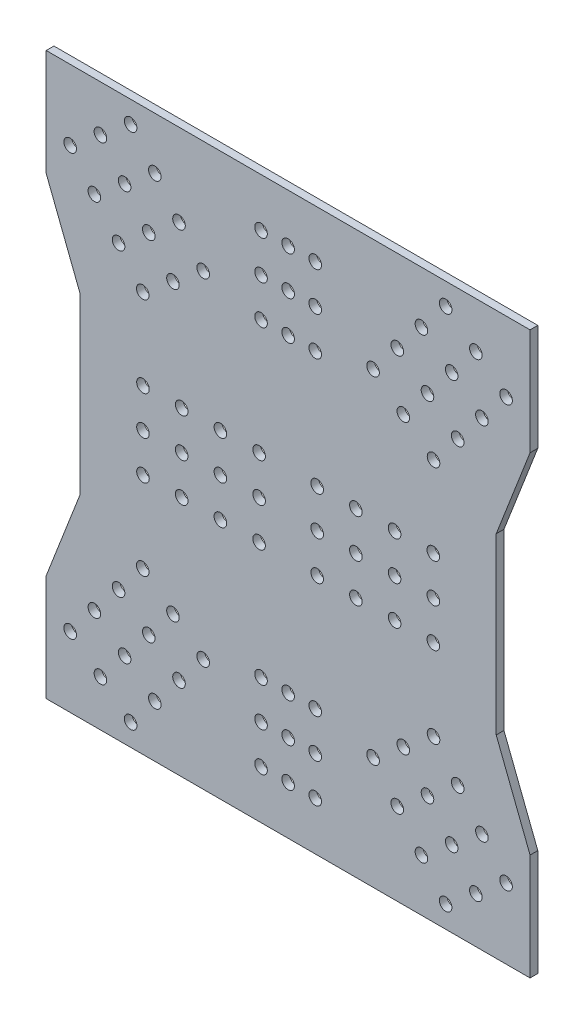
from build123d import *

# Parameters (mm, degrees)
SKETCH_2_W                        = 1000
SKETCH_2_H                        = 1160
EXTRUDE_1_DEPTH                   = 16
CUT_EXTRUDE_1_DEPTH               = 766.934723067
SKETCH_6_R                        = 13
CUT_EXTRUDE_2_DEPTH               = 766.934723067
PATTERN_LINEAR_1_COUNT            = 4
PATTERN_LINEAR_1_PITCH            = 80
PATTERN_LINEAR_1_COUNT_DIR2       = 3
PATTERN_LINEAR_1_PITCH_DIR2       = 80
PATTERN_LINEAR_2_COUNT            = 2
PATTERN_LINEAR_2_PITCH            = 360
PATTERN_LINEAR_2_COPY_1_SKETCH_R  = 13
PATTERN_LINEAR_2_COPY_1_DEPTH     = 766.934723067
PATTERN_LINEAR_2_COPY_2_SKETCH_R  = 13
PATTERN_LINEAR_2_COPY_2_DEPTH     = 766.934723067
PATTERN_LINEAR_2_COPY_3_SKETCH_R  = 13
PATTERN_LINEAR_2_COPY_3_DEPTH     = 766.934723067
PATTERN_LINEAR_2_COPY_4_SKETCH_R  = 13
PATTERN_LINEAR_2_COPY_4_DEPTH     = 766.934723067
PATTERN_LINEAR_2_COPY_5_SKETCH_R  = 13
PATTERN_LINEAR_2_COPY_5_DEPTH     = 766.934723067
PATTERN_LINEAR_2_COPY_6_SKETCH_R  = 13
PATTERN_LINEAR_2_COPY_6_DEPTH     = 766.934723067
PATTERN_LINEAR_2_COPY_7_SKETCH_R  = 13
PATTERN_LINEAR_2_COPY_7_DEPTH     = 766.934723067
PATTERN_LINEAR_2_COPY_8_SKETCH_R  = 13
PATTERN_LINEAR_2_COPY_8_DEPTH     = 766.934723067
PATTERN_LINEAR_2_COPY_9_SKETCH_R  = 13
PATTERN_LINEAR_2_COPY_9_DEPTH     = 766.934723067
PATTERN_LINEAR_2_COPY_10_SKETCH_R = 13
PATTERN_LINEAR_2_COPY_10_DEPTH    = 766.934723067
PATTERN_LINEAR_2_COPY_11_SKETCH_R = 13
PATTERN_LINEAR_2_COPY_11_DEPTH    = 766.934723067
SKETCH_7_R                        = 13
CUT_EXTRUDE_3_DEPTH               = 766.934723067
PATTERN_LINEAR_3_COUNT            = 3
PATTERN_LINEAR_3_PITCH            = 56
PATTERN_LINEAR_3_COUNT_DIR2       = 3
PATTERN_LINEAR_3_PITCH_DIR2       = 80
PATTERN_LINEAR_4_COUNT            = 2
PATTERN_LINEAR_4_PITCH            = 800
PATTERN_LINEAR_4_COPY_1_SKETCH_R  = 13
PATTERN_LINEAR_4_COPY_1_DEPTH     = 766.934723067
PATTERN_LINEAR_4_COPY_2_SKETCH_R  = 13
PATTERN_LINEAR_4_COPY_2_DEPTH     = 766.934723067
PATTERN_LINEAR_4_COPY_3_SKETCH_R  = 13
PATTERN_LINEAR_4_COPY_3_DEPTH     = 766.934723067
PATTERN_LINEAR_4_COPY_4_SKETCH_R  = 13
PATTERN_LINEAR_4_COPY_4_DEPTH     = 766.934723067
PATTERN_LINEAR_4_COPY_5_SKETCH_R  = 13
PATTERN_LINEAR_4_COPY_5_DEPTH     = 766.934723067
PATTERN_LINEAR_4_COPY_6_SKETCH_R  = 13
PATTERN_LINEAR_4_COPY_6_DEPTH     = 766.934723067
PATTERN_LINEAR_4_COPY_7_SKETCH_R  = 13
PATTERN_LINEAR_4_COPY_7_DEPTH     = 766.934723067
PATTERN_LINEAR_4_COPY_8_SKETCH_R  = 13
PATTERN_LINEAR_4_COPY_8_DEPTH     = 766.934723067
SKETCH_8_R                        = 13
CUT_EXTRUDE_4_DEPTH               = 766.934723067
MIRROR_2_COPY_1_SKETCH_R          = 13
MIRROR_2_COPY_1_DEPTH             = 766.934723067


with BuildPart() as part:
    # 草图2 → 凸台-拉伸1 (new body)
    with BuildSketch(Plane.XY):
        Rectangle(SKETCH_2_W, SKETCH_2_H)
    extrude(amount=EXTRUDE_1_DEPTH)

    # 草图4 → 切除-拉伸1 (cut, through all)
    with BuildSketch(Plane(origin=(0, 0, 0), x_dir=(-1, 0, 0), z_dir=(0, 0, -1))):
        Polygon((-500, 360), (-430, 180), (-430, -180), (-500, -360), align=None)
        Polygon((430, 180), (430, -180), (500, -360), (500, 360), align=None)
    extrude(amount=-CUT_EXTRUDE_1_DEPTH, mode=Mode.SUBTRACT)

    # 草图6 → 切除-拉伸2 (cut, through all)
    with BuildSketch(Plane.XY.offset(16)):
        with Locations((-60, 80)):
            Circle(SKETCH_6_R)
    cut_extrude_2 = extrude(amount=-CUT_EXTRUDE_2_DEPTH, mode=Mode.SUBTRACT)

    # 阵列(线性)1: Cut-Extrude 2 4 × 3
    with Locations(*[(-i * PATTERN_LINEAR_1_PITCH, -j * PATTERN_LINEAR_1_PITCH_DIR2, 0) for i in range(PATTERN_LINEAR_1_COUNT) for j in range(PATTERN_LINEAR_1_COUNT_DIR2) if (i, j) != (0, 0)]):
        add(cut_extrude_2, mode=Mode.SUBTRACT)

    # 阵列(线性)2: 切除-拉伸2 ×2
    with Locations(*[(i * PATTERN_LINEAR_2_PITCH, 0, 0) for i in range(1, PATTERN_LINEAR_2_COUNT)]):
        add(cut_extrude_2, mode=Mode.SUBTRACT)

    # 阵列(线性)2 copy 1 sketch → 阵列(线性)2 copy 1 (cut, through all)
    with BuildSketch(Plane(origin=(360, -80, 16), x_dir=(1, 0, 0), z_dir=(0, 0, 1))):
        with Locations((-60, 80)):
            Circle(PATTERN_LINEAR_2_COPY_1_SKETCH_R)
    extrude(amount=-PATTERN_LINEAR_2_COPY_1_DEPTH, mode=Mode.SUBTRACT)

    # 阵列(线性)2 copy 2 sketch → 阵列(线性)2 copy 2 (cut, through all)
    with BuildSketch(Plane(origin=(360, -160, 16), x_dir=(1, 0, 0), z_dir=(0, 0, 1))):
        with Locations((-60, 80)):
            Circle(PATTERN_LINEAR_2_COPY_2_SKETCH_R)
    extrude(amount=-PATTERN_LINEAR_2_COPY_2_DEPTH, mode=Mode.SUBTRACT)

    # 阵列(线性)2 copy 3 sketch → 阵列(线性)2 copy 3 (cut, through all)
    with BuildSketch(Plane(origin=(280, 0, 16), x_dir=(1, 0, 0), z_dir=(0, 0, 1))):
        with Locations((-60, 80)):
            Circle(PATTERN_LINEAR_2_COPY_3_SKETCH_R)
    extrude(amount=-PATTERN_LINEAR_2_COPY_3_DEPTH, mode=Mode.SUBTRACT)

    # 阵列(线性)2 copy 4 sketch → 阵列(线性)2 copy 4 (cut, through all)
    with BuildSketch(Plane(origin=(280, -80, 16), x_dir=(1, 0, 0), z_dir=(0, 0, 1))):
        with Locations((-60, 80)):
            Circle(PATTERN_LINEAR_2_COPY_4_SKETCH_R)
    extrude(amount=-PATTERN_LINEAR_2_COPY_4_DEPTH, mode=Mode.SUBTRACT)

    # 阵列(线性)2 copy 5 sketch → 阵列(线性)2 copy 5 (cut, through all)
    with BuildSketch(Plane(origin=(280, -160, 16), x_dir=(1, 0, 0), z_dir=(0, 0, 1))):
        with Locations((-60, 80)):
            Circle(PATTERN_LINEAR_2_COPY_5_SKETCH_R)
    extrude(amount=-PATTERN_LINEAR_2_COPY_5_DEPTH, mode=Mode.SUBTRACT)

    # 阵列(线性)2 copy 6 sketch → 阵列(线性)2 copy 6 (cut, through all)
    with BuildSketch(Plane(origin=(200, 0, 16), x_dir=(1, 0, 0), z_dir=(0, 0, 1))):
        with Locations((-60, 80)):
            Circle(PATTERN_LINEAR_2_COPY_6_SKETCH_R)
    extrude(amount=-PATTERN_LINEAR_2_COPY_6_DEPTH, mode=Mode.SUBTRACT)

    # 阵列(线性)2 copy 7 sketch → 阵列(线性)2 copy 7 (cut, through all)
    with BuildSketch(Plane(origin=(200, -80, 16), x_dir=(1, 0, 0), z_dir=(0, 0, 1))):
        with Locations((-60, 80)):
            Circle(PATTERN_LINEAR_2_COPY_7_SKETCH_R)
    extrude(amount=-PATTERN_LINEAR_2_COPY_7_DEPTH, mode=Mode.SUBTRACT)

    # 阵列(线性)2 copy 8 sketch → 阵列(线性)2 copy 8 (cut, through all)
    with BuildSketch(Plane(origin=(200, -160, 16), x_dir=(1, 0, 0), z_dir=(0, 0, 1))):
        with Locations((-60, 80)):
            Circle(PATTERN_LINEAR_2_COPY_8_SKETCH_R)
    extrude(amount=-PATTERN_LINEAR_2_COPY_8_DEPTH, mode=Mode.SUBTRACT)

    # 阵列(线性)2 copy 9 sketch → 阵列(线性)2 copy 9 (cut, through all)
    with BuildSketch(Plane(origin=(120, 0, 16), x_dir=(1, 0, 0), z_dir=(0, 0, 1))):
        with Locations((-60, 80)):
            Circle(PATTERN_LINEAR_2_COPY_9_SKETCH_R)
    extrude(amount=-PATTERN_LINEAR_2_COPY_9_DEPTH, mode=Mode.SUBTRACT)

    # 阵列(线性)2 copy 10 sketch → 阵列(线性)2 copy 10 (cut, through all)
    with BuildSketch(Plane(origin=(120, -80, 16), x_dir=(1, 0, 0), z_dir=(0, 0, 1))):
        with Locations((-60, 80)):
            Circle(PATTERN_LINEAR_2_COPY_10_SKETCH_R)
    extrude(amount=-PATTERN_LINEAR_2_COPY_10_DEPTH, mode=Mode.SUBTRACT)

    # 阵列(线性)2 copy 11 sketch → 阵列(线性)2 copy 11 (cut, through all)
    with BuildSketch(Plane(origin=(120, -160, 16), x_dir=(1, 0, 0), z_dir=(0, 0, 1))):
        with Locations((-60, 80)):
            Circle(PATTERN_LINEAR_2_COPY_11_SKETCH_R)
    extrude(amount=-PATTERN_LINEAR_2_COPY_11_DEPTH, mode=Mode.SUBTRACT)

    # 草图7 → 切除-拉伸3 (cut, through all)
    with BuildSketch(Plane.XY.offset(16)):
        with Locations((-56, 480)):
            Circle(SKETCH_7_R)
    cut_extrude_3 = extrude(amount=-CUT_EXTRUDE_3_DEPTH, mode=Mode.SUBTRACT)

    # 阵列(线性)3: Cut-Extrude 3 3 × 3
    with Locations(*[(i * PATTERN_LINEAR_3_PITCH, -j * PATTERN_LINEAR_3_PITCH_DIR2, 0) for i in range(PATTERN_LINEAR_3_COUNT) for j in range(PATTERN_LINEAR_3_COUNT_DIR2) if (i, j) != (0, 0)]):
        add(cut_extrude_3, mode=Mode.SUBTRACT)

    # 阵列(线性)4: 切除-拉伸3 ×2
    with Locations(*[(0, -i * PATTERN_LINEAR_4_PITCH, 0) for i in range(1, PATTERN_LINEAR_4_COUNT)]):
        add(cut_extrude_3, mode=Mode.SUBTRACT)

    # 阵列(线性)4 copy 1 sketch → 阵列(线性)4 copy 1 (cut, through all)
    with BuildSketch(Plane(origin=(0, -880, 16), x_dir=(1, 0, 0), z_dir=(0, 0, 1))):
        with Locations((-56, 480)):
            Circle(PATTERN_LINEAR_4_COPY_1_SKETCH_R)
    extrude(amount=-PATTERN_LINEAR_4_COPY_1_DEPTH, mode=Mode.SUBTRACT)

    # 阵列(线性)4 copy 2 sketch → 阵列(线性)4 copy 2 (cut, through all)
    with BuildSketch(Plane(origin=(0, -960, 16), x_dir=(1, 0, 0), z_dir=(0, 0, 1))):
        with Locations((-56, 480)):
            Circle(PATTERN_LINEAR_4_COPY_2_SKETCH_R)
    extrude(amount=-PATTERN_LINEAR_4_COPY_2_DEPTH, mode=Mode.SUBTRACT)

    # 阵列(线性)4 copy 3 sketch → 阵列(线性)4 copy 3 (cut, through all)
    with BuildSketch(Plane(origin=(56, -800, 16), x_dir=(1, 0, 0), z_dir=(0, 0, 1))):
        with Locations((-56, 480)):
            Circle(PATTERN_LINEAR_4_COPY_3_SKETCH_R)
    extrude(amount=-PATTERN_LINEAR_4_COPY_3_DEPTH, mode=Mode.SUBTRACT)

    # 阵列(线性)4 copy 4 sketch → 阵列(线性)4 copy 4 (cut, through all)
    with BuildSketch(Plane(origin=(56, -880, 16), x_dir=(1, 0, 0), z_dir=(0, 0, 1))):
        with Locations((-56, 480)):
            Circle(PATTERN_LINEAR_4_COPY_4_SKETCH_R)
    extrude(amount=-PATTERN_LINEAR_4_COPY_4_DEPTH, mode=Mode.SUBTRACT)

    # 阵列(线性)4 copy 5 sketch → 阵列(线性)4 copy 5 (cut, through all)
    with BuildSketch(Plane(origin=(56, -960, 16), x_dir=(1, 0, 0), z_dir=(0, 0, 1))):
        with Locations((-56, 480)):
            Circle(PATTERN_LINEAR_4_COPY_5_SKETCH_R)
    extrude(amount=-PATTERN_LINEAR_4_COPY_5_DEPTH, mode=Mode.SUBTRACT)

    # 阵列(线性)4 copy 6 sketch → 阵列(线性)4 copy 6 (cut, through all)
    with BuildSketch(Plane(origin=(112, -800, 16), x_dir=(1, 0, 0), z_dir=(0, 0, 1))):
        with Locations((-56, 480)):
            Circle(PATTERN_LINEAR_4_COPY_6_SKETCH_R)
    extrude(amount=-PATTERN_LINEAR_4_COPY_6_DEPTH, mode=Mode.SUBTRACT)

    # 阵列(线性)4 copy 7 sketch → 阵列(线性)4 copy 7 (cut, through all)
    with BuildSketch(Plane(origin=(112, -880, 16), x_dir=(1, 0, 0), z_dir=(0, 0, 1))):
        with Locations((-56, 480)):
            Circle(PATTERN_LINEAR_4_COPY_7_SKETCH_R)
    extrude(amount=-PATTERN_LINEAR_4_COPY_7_DEPTH, mode=Mode.SUBTRACT)

    # 阵列(线性)4 copy 8 sketch → 阵列(线性)4 copy 8 (cut, through all)
    with BuildSketch(Plane(origin=(112, -960, 16), x_dir=(1, 0, 0), z_dir=(0, 0, 1))):
        with Locations((-56, 480)):
            Circle(PATTERN_LINEAR_4_COPY_8_SKETCH_R)
    extrude(amount=-PATTERN_LINEAR_4_COPY_8_DEPTH, mode=Mode.SUBTRACT)

    # 草图8 → 切除-拉伸4 (cut, through all)
    with BuildSketch(Plane.XY.offset(16)):
        with Locations((175.539308363, 347.486620202)):
            Circle(SKETCH_8_R)
        with Locations((300.478317874, 247.535412593)):
            Circle(SKETCH_8_R)
        with Locations((225.514912167, 409.956124958)):
            Circle(SKETCH_8_R)
        with Locations((275.490515972, 472.425629713)):
            Circle(SKETCH_8_R)
        with Locations((325.466119776, 534.895134468)):
            Circle(SKETCH_8_R)
        with Locations((387.935624531, 484.919530664)):
            Circle(SKETCH_8_R)
        with Locations((337.960020727, 422.450025909)):
            Circle(SKETCH_8_R)
        with Locations((287.984416923, 359.980521153)):
            Circle(SKETCH_8_R)
        with Locations((450.405129287, 434.94392686)):
            Circle(SKETCH_8_R)
        with Locations((400.429525482, 372.474422104)):
            Circle(SKETCH_8_R)
        with Locations((350.453921678, 310.004917349)):
            Circle(SKETCH_8_R)
        with Locations((238.008813118, 297.511016398)):
            Circle(SKETCH_8_R)
    cut_extrude_4 = extrude(amount=-CUT_EXTRUDE_4_DEPTH, mode=Mode.SUBTRACT)

    # 镜向1: 切除-拉伸4 across plane
    add(cut_extrude_4.mirror(Plane(origin=(0, 0, 0), x_dir=(0, 0, 1), z_dir=(1, 0, 0))), mode=Mode.SUBTRACT)

    # 镜向2: 切除-拉伸4 across plane
    add(cut_extrude_4.mirror(Plane.ZX), mode=Mode.SUBTRACT)

    # 镜向2 copy 1 sketch → 镜向2 copy 1 (cut, through all)
    with BuildSketch(Plane(origin=(0, 0, 16), x_dir=(-1, 0, 0), z_dir=(0, 0, 1))):
        with Locations((175.539308363, 347.486620202)):
            Circle(MIRROR_2_COPY_1_SKETCH_R)
        with Locations((300.478317874, 247.535412593)):
            Circle(MIRROR_2_COPY_1_SKETCH_R)
        with Locations((225.514912167, 409.956124958)):
            Circle(MIRROR_2_COPY_1_SKETCH_R)
        with Locations((275.490515972, 472.425629713)):
            Circle(MIRROR_2_COPY_1_SKETCH_R)
        with Locations((325.466119776, 534.895134468)):
            Circle(MIRROR_2_COPY_1_SKETCH_R)
        with Locations((387.935624531, 484.919530664)):
            Circle(MIRROR_2_COPY_1_SKETCH_R)
        with Locations((337.960020727, 422.450025909)):
            Circle(MIRROR_2_COPY_1_SKETCH_R)
        with Locations((287.984416923, 359.980521153)):
            Circle(MIRROR_2_COPY_1_SKETCH_R)
        with Locations((450.405129287, 434.94392686)):
            Circle(MIRROR_2_COPY_1_SKETCH_R)
        with Locations((400.429525482, 372.474422104)):
            Circle(MIRROR_2_COPY_1_SKETCH_R)
        with Locations((350.453921678, 310.004917349)):
            Circle(MIRROR_2_COPY_1_SKETCH_R)
        with Locations((238.008813118, 297.511016398)):
            Circle(MIRROR_2_COPY_1_SKETCH_R)
    extrude(amount=-MIRROR_2_COPY_1_DEPTH, mode=Mode.SUBTRACT)


solid = part.part
